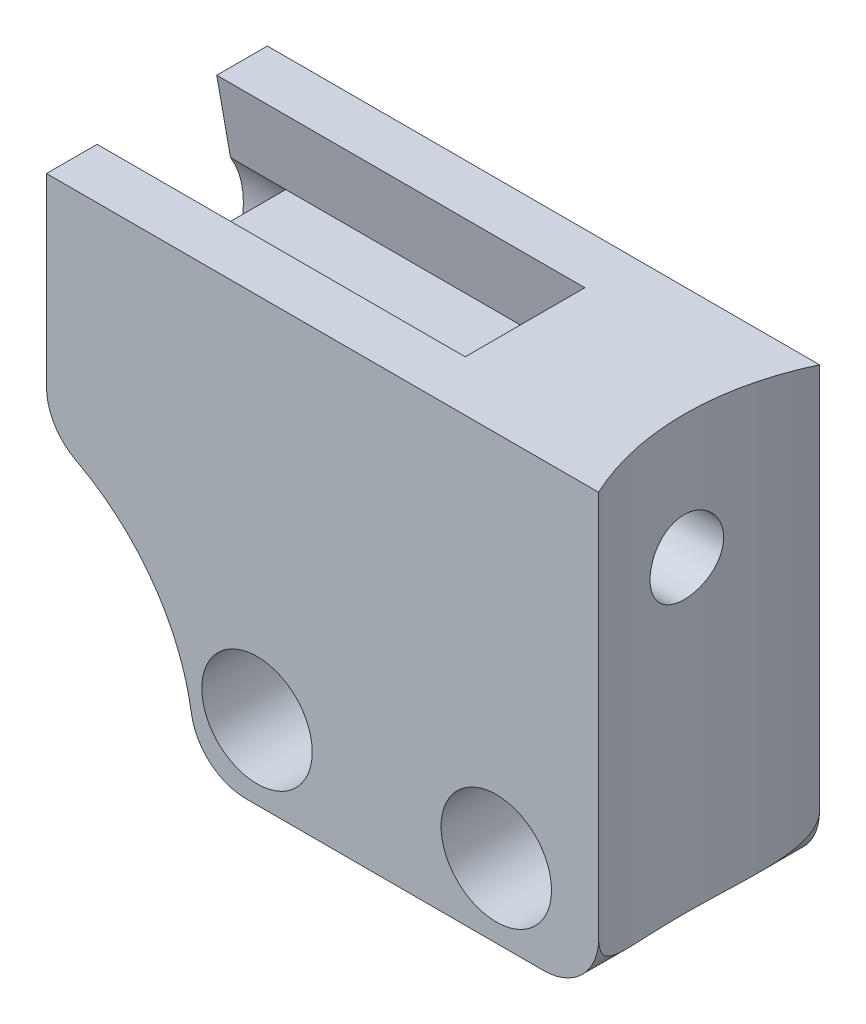
from build123d import *

# Parameters (mm, degrees)
SKETCH_1_R          = 3
EXTRUDE_1_DEPTH     = 6
CUT_EXTRUDE_3_DEPTH = 20
CUT_EXTRUDE_4_DEPTH = 3
SKETCH_6_R          = 2
CUT_EXTRUDE_5_DEPTH = 31.149626883
CUT_EXTRUDE_6_DEPTH = 29.930952356


with BuildPart() as part:
    # 草图1 → 凸台-拉伸1 (new, symmetric)
    with BuildSketch(Plane.XY):
        with BuildLine():
            Line((-15, 12), (15, 12))
            Line((15, 12), (15, -9))
            ThreePointArc((15, -9), (14.121320344, -11.121320344), (12, -12))
            Line((12, -12), (-4.161323267, -12))
            ThreePointArc((-4.161323267, -12), (-6.111669593, -11.279506353), (-7.125207826, -9.464099475))
            ThreePointArc((-7.125207826, -9.464099475), (-9.221365462, -4.338055801), (-13.396149212, -0.69918493))
            ThreePointArc((-13.396149212, -0.69918493), (-14.567922082, 0.405086708), (-15, 1.956143181))
            Line((-15, 1.956143181), (-15, 12))
        make_face()
        with Locations((-3.56187291, -8)):
            Circle(SKETCH_1_R, mode=Mode.SUBTRACT)
        with Locations((9.43812709, -8)):
            Circle(SKETCH_1_R, mode=Mode.SUBTRACT)
    extrude(amount=EXTRUDE_1_DEPTH, both=True)

    # 草图2 → 切除-拉伸3 (cut)
    with BuildSketch(Plane.ZY.offset(15)):
        Polygon((-3.25, 12), (-4, 7.746538635), (0, 7.746538635), (0, 12), align=None)
        Polygon((0, 7.746538635), (4, 7.746538635), (3.25, 12), (0, 12), align=None)
    extrude(amount=-CUT_EXTRUDE_3_DEPTH, mode=Mode.SUBTRACT)

    # 草图5 → 切除-拉伸4 (cut)
    with BuildSketch(Plane.ZY.offset(15)):
        with BuildLine():
            Line((-4, 7.746538635), (4, 7.746538635))
            ThreePointArc((4, 7.746538635), (0, 0.578746099), (-4, 7.746538635))
        make_face()
    extrude(amount=-CUT_EXTRUDE_4_DEPTH, mode=Mode.SUBTRACT)

    # 草图6 → 切除-拉伸5 (cut, through all)
    with BuildSketch(Plane.ZY.offset(12)):
        with Locations((0, 5.278746099)):
            Circle(SKETCH_6_R)
    extrude(amount=-CUT_EXTRUDE_5_DEPTH, mode=Mode.SUBTRACT)

    # 草图7 → 切除-拉伸6 (cut, through all)
    with BuildSketch(Plane(origin=(0, 12, 0), x_dir=(1, 0, 0), z_dir=(0, 1, 0))):
        with BuildLine():
            Line((15, 6), (15, -6))
            ThreePointArc((15, -6), (13.649110641, 0), (15, 6))
        make_face()
    extrude(amount=-CUT_EXTRUDE_6_DEPTH, mode=Mode.SUBTRACT)


solid = part.part
